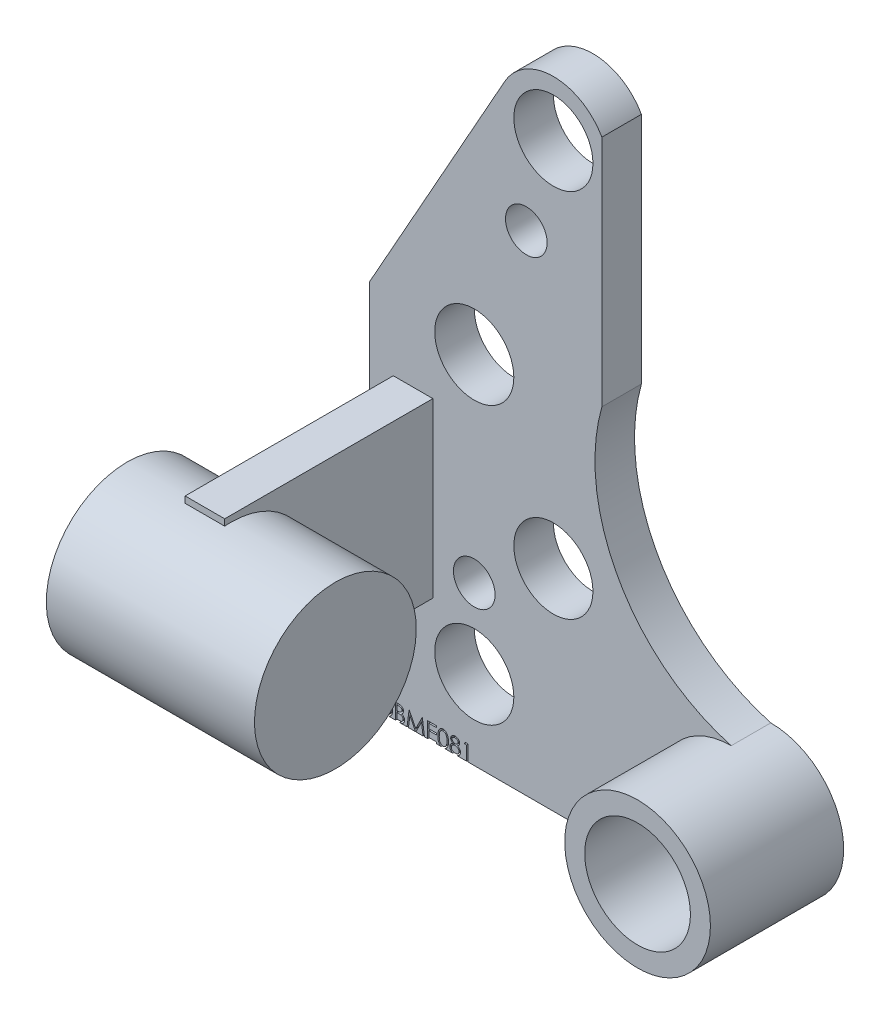
from build123d import *

# Parameters (mm, degrees)
SKETCH1_R           = 19
SKETCH1_R_2         = 10
SKETCH1_R_3         = 25.4
BOSS_EXTRUDE1_DEPTH = 19
SKETCH1_6_R         = 25.4
BOSS_EXTRUDE2_DEPTH = 64
CUT_EXTRUDE1_DEPTH  = 5
SKETCH2_W           = 19
SKETCH2_H           = 83
BOSS_EXTRUDE5_DEPTH = 100
SKETCH6_R           = 38.858564493
BOSS_EXTRUDE6_DEPTH = 50


with BuildPart() as part:
    # Sketch1 → Boss-Extrude1 (new body)
    with BuildSketch(Plane.XY):
        with BuildLine():
            Line((-50.379383599, 137.990211841), (-50.379383599, -38.009788159))
            Line((-50.379383599, -38.009788159), (123.435859453, -38.009788159))
            ThreePointArc((123.435859453, -38.009788159), (158.435859453, -3.009788159), (123.435859453, 31.990211841))
            ThreePointArc((123.435859453, 31.990211841), (69.500354361, 74.012890391), (61.288003042, 141.891469545))
            Line((61.288003042, 141.891469545), (61.288003042, 254.059820607))
            ThreePointArc((61.288003042, 254.059820607), (38, 267.7), (14.711996958, 254.059820607))
            Line((14.711996958, 254.059820607), (-50.379383599, 137.990211841))
        make_face()
        Circle(SKETCH1_R, mode=Mode.SUBTRACT)
        with Locations((0, 38)):
            Circle(SKETCH1_R_2, mode=Mode.SUBTRACT)
        with Locations((38, 63)):
            Circle(SKETCH1_R, mode=Mode.SUBTRACT)
        with Locations((0, 133)):
            Circle(SKETCH1_R, mode=Mode.SUBTRACT)
        with Locations((25, 197)):
            Circle(SKETCH1_R_2, mode=Mode.SUBTRACT)
        with Locations((38, 241)):
            Circle(SKETCH1_R, mode=Mode.SUBTRACT)
        with Locations((123.435859453, -3.009788159)):
            Circle(SKETCH1_R_3, mode=Mode.SUBTRACT)
    extrude(amount=BOSS_EXTRUDE1_DEPTH)

    # Sketch1<6> → Boss-Extrude2 (add)
    with BuildSketch(Plane.XY):
        with BuildLine():
            ThreePointArc((123.435859453, 31.990211841), (88.435859453, -3.009788159), (123.435859453, -38.009788159))
            ThreePointArc((123.435859453, -38.009788159), (148.184596795, -27.7585255), (158.435859453, -3.009788159))
            ThreePointArc((158.435859453, -3.009788159), (148.184596795, 21.738949183), (123.435859453, 31.990211841))
        make_face()
        with Locations((123.435859453, -3.009788159)):
            Circle(SKETCH1_6_R, mode=Mode.SUBTRACT)
    extrude(amount=BOSS_EXTRUDE2_DEPTH)

    # Sketch5 → Cut-Extrude1 (cut)
    # profile 1 of 8: a face of its own
    with BuildSketch(Plane.XY.offset(19)):
        with BuildLine():
            Line((-49.129383599, -32.817480467), (-49.802460522, -32.817480467))
            add(Edge.make_bspline(
                [(-49.802460522, -32.817480467), (-49.798073766, -32.728185707), (-49.789458293, -32.552813176), (-49.749111959, -32.297119091), (-49.691381508, -32.052715951), (-49.609756963, -31.821566135), (-49.508386368, -31.601625834), (-49.386822024, -31.393768657), (-49.242835201, -31.198787538), (-49.079535057, -31.018490017), (-48.902173687, -30.85308808), (-48.710803817, -30.710255417), (-48.50970733, -30.589574692), (-48.299494332, -30.488686317), (-48.077793125, -30.412958076), (-47.846615572, -30.356768848), (-47.604945994, -30.322962393), (-47.440288804, -30.319328566), (-47.356547061, -30.317480467)],
                knots=[0, 0, 0, 0, 1.10065271, 2.161652631, 3.183658789, 4.190468796, 5.17591951, 6.163126047, 7.15150782, 8.156236427, 9.156009102, 10.134482811, 11.092018607, 12.041330605, 13.001268258, 13.972401359, 14.968799086, 16, 16, 16, 16], degree=3))
            add(Edge.make_bspline(
                [(-47.356547061, -30.317480467), (-47.274308331, -30.31940573), (-47.112712163, -30.323188805), (-46.87686499, -30.355676725), (-46.652342216, -30.406560135), (-46.439582716, -30.477950313), (-46.240284006, -30.573916943), (-46.052948911, -30.689197383), (-45.875347173, -30.822525593), (-45.715475494, -30.979498051), (-45.568672467, -31.147074589), (-45.442024778, -31.32597724), (-45.333567999, -31.51075428), (-45.243165828, -31.702814712), (-45.176616958, -31.903966916), (-45.126092227, -32.111282351), (-45.097533483, -32.326906946), (-45.093150433, -32.472849565), (-45.090922061, -32.547047774)],
                knots=[0, 0, 0, 0, 1.111607364, 2.184268762, 3.212621178, 4.221274766, 5.211760367, 6.196651075, 7.1921475, 8.207485113, 9.220403448, 10.201281604, 11.166441695, 12.114753415, 13.065576456, 14.026450734, 14.996634279, 16, 16, 16, 16], degree=3))
            add(Edge.make_bspline(
                [(-45.090922061, -32.547047774), (-45.094550481, -32.65150742), (-45.101743648, -32.858593592), (-45.163274455, -33.162911155), (-45.259374122, -33.457754196), (-45.375082744, -33.695048415), (-45.49180941, -33.886263044), (-45.596996926, -34.043695983), (-45.720135807, -34.213207701), (-45.863018302, -34.394230567), (-46.022688743, -34.588182506), (-46.200593378, -34.794946354), (-46.39800084, -35.01238586), (-46.53655477, -35.160897863), (-46.608349945, -35.237853063)],
                knots=[0, 0, 0, 0, 1.184426356, 2.348067706, 3.509069118, 4.696110526, 5.333549288, 6.050745305, 6.844228056, 7.710549037, 8.667450064, 9.695053472, 10.805634456, 12, 12, 12, 12], degree=3))
            Line((-46.608349945, -35.237853063), (-48.484852349, -37.24055739))
            Line((-48.484852349, -37.24055739), (-44.994768215, -37.24055739))
            Line((-44.994768215, -37.24055739), (-44.994768215, -38.009788159))
            Line((-44.994768215, -38.009788159), (-50.090922061, -38.009788159))
            Line((-50.090922061, -38.009788159), (-47.182268215, -34.905821813))
            add(Edge.make_bspline(
                [(-47.182268215, -34.905821813), (-47.111451314, -34.83189687), (-46.975426542, -34.689902184), (-46.783035306, -34.482595841), (-46.610237474, -34.290275397), (-46.455914489, -34.113304222), (-46.323414121, -33.949093719), (-46.205830766, -33.802962212), (-46.111618786, -33.668488389), (-46.009371509, -33.512615645), (-45.910341549, -33.322303537), (-45.825243643, -33.089731346), (-45.773354682, -32.850315804), (-45.767130035, -32.688525725), (-45.763998984, -32.607143928)],
                knots=[0, 0, 0, 0, 1.329631726, 2.553950428, 3.673215718, 4.687767853, 5.603093632, 6.413772471, 7.123043292, 7.734684054, 8.834405432, 9.900288307, 10.943827018, 12, 12, 12, 12], degree=3))
            add(Edge.make_bspline(
                [(-45.763998984, -32.607143928), (-45.765361289, -32.555969503), (-45.76804613, -32.455114538), (-45.791741196, -32.307245054), (-45.827549424, -32.164606167), (-45.878860691, -32.026759126), (-45.94658942, -31.895089872), (-46.029032377, -31.769438129), (-46.124153941, -31.647961775), (-46.234192375, -31.53406185), (-46.355074203, -31.429744981), (-46.482776167, -31.337336227), (-46.617883533, -31.260109561), (-46.759826652, -31.196802067), (-46.908209801, -31.147140536), (-47.063319969, -31.112729294), (-47.224728575, -31.091123972), (-47.334943209, -31.088200746), (-47.391102349, -31.086711236)],
                knots=[0, 0, 0, 0, 0.991446411, 1.95395049, 2.89581595, 3.838931463, 4.798493298, 5.75982156, 6.748411868, 7.785213223, 8.824556874, 9.840280684, 10.836137867, 11.835679398, 12.848801643, 13.863922112, 14.911575587, 16, 16, 16, 16], degree=3))
            add(Edge.make_bspline(
                [(-47.391102349, -31.086711236), (-47.449754134, -31.088243448), (-47.564936554, -31.091252459), (-47.734048768, -31.112301025), (-47.895375434, -31.14861354), (-48.049322369, -31.198277842), (-48.196150053, -31.261403304), (-48.335144433, -31.340028471), (-48.465993481, -31.433850242), (-48.588943174, -31.540222863), (-48.702223129, -31.658653437), (-48.801752149, -31.790674786), (-48.888717893, -31.933876391), (-48.964594822, -32.087871856), (-49.026214158, -32.254058528), (-49.07329948, -32.431846467), (-49.110557009, -32.620463712), (-49.123003839, -32.750717466), (-49.129383599, -32.817480467)],
                knots=[0, 0, 0, 0, 1.031018746, 2.02475058, 2.990194455, 3.934040569, 4.864654155, 5.795059489, 6.735614925, 7.690564532, 8.649604399, 9.611025574, 10.590972636, 11.591080095, 12.624614302, 13.701020113, 14.821632451, 16, 16, 16, 16], degree=3))
        make_face()
    # profile 2 of 8: a face of its own
    with BuildSketch(Plane.XY.offset(19)):
        with BuildLine():
            add(Edge.make_bspline(
                [(-44.321691292, -34.262792967), (-44.320988395, -34.142584279), (-44.31962301, -33.909077169), (-44.304433536, -33.568824365), (-44.27920066, -33.249623746), (-44.244620575, -32.951460033), (-44.202539189, -32.674256252), (-44.146363146, -32.418753201), (-44.082478569, -32.183768329), (-44.008437614, -31.968535368), (-43.924892352, -31.770154576), (-43.833961793, -31.584957716), (-43.732037234, -31.413225004), (-43.624943849, -31.252215453), (-43.508346552, -31.104564679), (-43.38556343, -30.968187545), (-43.251802267, -30.846235936), (-43.111610106, -30.735136717), (-42.963717682, -30.637744992), (-42.812340541, -30.551960552), (-42.656436742, -30.478675122), (-42.495580636, -30.42105276), (-42.331218012, -30.373458088), (-42.162774298, -30.340910343), (-41.989971375, -30.320431254), (-41.873332586, -30.318473394), (-41.814179272, -30.317480467)],
                knots=[0, 0, 0, 0, 1.646270934, 3.197905019, 4.663502075, 6.030701355, 7.308322542, 8.50163776, 9.611534131, 10.641858119, 11.616356847, 12.558055219, 13.465016945, 14.349605745, 15.204443733, 16.039544428, 16.859896111, 17.680448484, 18.487036065, 19.28249412, 20.06191084, 20.843045899, 21.620316918, 22.403196591, 23.190181807, 24, 24, 24, 24], degree=3))
            add(Edge.make_bspline(
                [(-41.814179272, -30.317480467), (-41.754531818, -30.318525785), (-41.635911799, -30.320604594), (-41.460539567, -30.340584471), (-41.28921882, -30.373736877), (-41.122679951, -30.420710394), (-40.95955498, -30.478986844), (-40.801119821, -30.552030667), (-40.646390361, -30.637056811), (-40.497825459, -30.736965119), (-40.35379414, -30.848355711), (-40.217834219, -30.974275716), (-40.089933321, -31.113453686), (-39.968486238, -31.264400537), (-39.85693853, -31.430011433), (-39.750709747, -31.607405954), (-39.655626812, -31.799686379), (-39.564052508, -32.003644524), (-39.485008965, -32.224923793), (-39.413724154, -32.462276851), (-39.356126364, -32.718507252), (-39.308149352, -32.992270634), (-39.270981718, -33.284572384), (-39.243911771, -33.594785917), (-39.229612303, -33.923115326), (-39.226919372, -34.147596431), (-39.225537445, -34.262792967)],
                knots=[0, 0, 0, 0, 0.810914788, 1.612654377, 2.396697861, 3.181598691, 3.963628158, 4.749916497, 5.551656086, 6.361998678, 7.18212741, 8.025565596, 8.878627764, 9.750805457, 10.657531673, 11.591944965, 12.560506719, 13.57287815, 14.630710178, 15.753379473, 16.941251878, 18.199788006, 19.531962791, 20.947069417, 22.433333509, 24, 24, 24, 24], degree=3))
            add(Edge.make_bspline(
                [(-39.225537445, -34.262792967), (-39.226933698, -34.377487055), (-39.229654239, -34.600963809), (-39.243751468, -34.927815899), (-39.271519963, -35.236383135), (-39.306255653, -35.527405554), (-39.354364859, -35.79967188), (-39.413518787, -36.05412427), (-39.47919805, -36.291861566), (-39.560272609, -36.510936162), (-39.649009845, -36.71440414), (-39.745556694, -36.904405172), (-39.848992036, -37.082618656), (-39.961682204, -37.247618114), (-40.08179666, -37.400572379), (-40.211906208, -37.538781571), (-40.348343176, -37.665575868), (-40.492798353, -37.778400784), (-40.643680248, -37.877153937), (-40.79787827, -37.96546933), (-40.958128377, -38.036682248), (-41.12079899, -38.097828765), (-41.288216918, -38.144544019), (-41.460173469, -38.176845138), (-41.635793975, -38.199499099), (-41.754511614, -38.20122727), (-41.814179272, -38.202095851)],
                knots=[0, 0, 0, 0, 1.561518951, 3.042555995, 4.452378317, 5.7783523, 7.031515105, 8.214008947, 9.334062868, 10.386615937, 11.391082383, 12.354592575, 13.286541444, 14.194233754, 15.072674879, 15.931287219, 16.775624067, 17.606195743, 18.42308326, 19.229000347, 20.022332153, 20.807536673, 21.593273796, 22.3848459, 23.188221202, 24, 24, 24, 24], degree=3))
            add(Edge.make_bspline(
                [(-41.814179272, -38.202095851), (-41.873330945, -38.201096518), (-41.989966498, -38.199126028), (-42.162793124, -38.178739461), (-42.330541217, -38.145963382), (-42.494038547, -38.100070659), (-42.654123937, -38.04389601), (-42.80861598, -37.970709545), (-42.959232445, -37.886422255), (-43.105571493, -37.790432066), (-43.244883267, -37.68045703), (-43.377951707, -37.558819269), (-43.501433891, -37.422483388), (-43.616364096, -37.273602124), (-43.725594285, -37.113545176), (-43.826071513, -36.940127234), (-43.919009058, -36.754035926), (-44.003959395, -36.554068974), (-44.079277959, -36.337308414), (-44.145808762, -36.10127446), (-44.1983391, -35.843883812), (-44.243302576, -35.567203739), (-44.279569111, -35.270045317), (-44.304328379, -34.952247221), (-44.319631197, -34.614007488), (-44.320992062, -34.382000828), (-44.321691292, -34.262792967)],
                knots=[0, 0, 0, 0, 0.810891512, 1.598919785, 2.382837074, 3.152667961, 3.926044502, 4.706494248, 5.493654104, 6.291793342, 7.103789334, 7.925228297, 8.761435821, 9.622817696, 10.50288917, 11.416980706, 12.369136599, 13.353924996, 14.394355917, 15.514179734, 16.714354668, 17.994756427, 19.357759367, 20.818452758, 22.365282078, 24, 24, 24, 24], degree=3))
        make_face()
        with BuildLine():
            add(Edge.make_bspline(
                [(-43.648614368, -34.259788159), (-43.64835841, -34.359963942), (-43.647861646, -34.554385467), (-43.634884074, -34.83690674), (-43.617205005, -35.100414588), (-43.594402225, -35.345243594), (-43.560538764, -35.57056505), (-43.522595647, -35.777928656), (-43.47642117, -35.966237021), (-43.421788989, -36.13678233), (-43.359562352, -36.292458905), (-43.291621216, -36.437318652), (-43.218633953, -36.573072802), (-43.136950058, -36.698501962), (-43.047989209, -36.814015171), (-42.953760796, -36.921656955), (-42.850748116, -37.017650486), (-42.708240096, -37.132779461), (-42.520104794, -37.251749033), (-42.283060961, -37.355347797), (-42.039485709, -37.420453061), (-41.874161602, -37.428732538), (-41.791643215, -37.432865082)],
                knots=[0, 0, 0, 0, 1.459021318, 2.831673884, 4.118529203, 5.306027144, 6.411944654, 7.436330062, 8.375795394, 9.233974572, 10.042671642, 10.816086306, 11.563610507, 12.285937304, 12.993564865, 13.685989202, 14.367179055, 15.041617293, 16.353048772, 17.594441528, 18.799311195, 20, 20, 20, 20], degree=3))
            add(Edge.make_bspline(
                [(-41.791643215, -37.432865082), (-41.708591061, -37.429441266), (-41.542658226, -37.422600703), (-41.300228665, -37.356603408), (-41.064878086, -37.257025824), (-40.880438214, -37.139281169), (-40.740118478, -37.027149035), (-40.63958207, -36.931546217), (-40.547306252, -36.82449793), (-40.459787521, -36.708999439), (-40.379518073, -36.582844115), (-40.306525635, -36.446638597), (-40.239918461, -36.300004644), (-40.201970506, -36.197640918), (-40.182568695, -36.145304986)],
                knots=[0, 0, 0, 0, 1.353760809, 2.704726607, 4.075137775, 5.516104923, 6.260822281, 7.007110065, 7.778089737, 8.566572457, 9.372053459, 10.217411131, 11.088608312, 12, 12, 12, 12], degree=3))
            add(Edge.make_bspline(
                [(-40.182568695, -36.145304986), (-40.159957764, -36.078384115), (-40.114047878, -35.942506049), (-40.05487979, -35.731726795), (-40.008282506, -35.510578015), (-39.966361008, -35.280381336), (-39.937747317, -35.03943912), (-39.914716288, -34.788496869), (-39.90115053, -34.527365378), (-39.899468921, -34.34994754), (-39.898614368, -34.259788159)],
                knots=[0, 0, 0, 0, 0.884706709, 1.796334032, 2.740027952, 3.714592787, 4.726048262, 5.777819803, 6.87074269, 8, 8, 8, 8], degree=3))
            add(Edge.make_bspline(
                [(-39.898614368, -34.259788159), (-39.899793345, -34.169643361), (-39.902099676, -33.993300865), (-39.910915364, -33.73504762), (-39.933680167, -33.489759561), (-39.958963993, -33.256379977), (-39.996243752, -33.036200757), (-40.036439053, -32.827378674), (-40.090441651, -32.632500764), (-40.148126883, -32.448515946), (-40.214149159, -32.277514543), (-40.286825732, -32.118699287), (-40.364443787, -31.971303448), (-40.448748588, -31.83573143), (-40.538739337, -31.711375981), (-40.636791228, -31.600730422), (-40.739014884, -31.50036549), (-40.882194568, -31.385802842), (-41.069639475, -31.268992066), (-41.302880148, -31.161494009), (-41.545602957, -31.099761953), (-41.70968893, -31.091058338), (-41.791643215, -31.086711236)],
                knots=[0, 0, 0, 0, 1.31362396, 2.569729283, 3.763502607, 4.902122613, 5.988968491, 7.01645872, 7.998833611, 8.933434873, 9.825090667, 10.667526885, 11.477055099, 12.250526234, 12.991942729, 13.710640831, 14.402115721, 15.076753259, 16.378508321, 17.609869233, 18.806226677, 20, 20, 20, 20], degree=3))
            add(Edge.make_bspline(
                [(-41.791643215, -31.086711236), (-41.874594483, -31.091064336), (-42.040648138, -31.099778466), (-42.285893755, -31.161264009), (-42.520974509, -31.268434651), (-42.70792374, -31.386189734), (-42.851203283, -31.498343259), (-42.952094769, -31.595599946), (-43.046693709, -31.701984777), (-43.133838781, -31.818560309), (-43.215458674, -31.943843239), (-43.290417986, -32.078819163), (-43.357955121, -32.224172087), (-43.420279127, -32.379778734), (-43.475077959, -32.550309329), (-43.520279309, -32.738385744), (-43.56203728, -32.945089798), (-43.59159857, -33.171631601), (-43.617878047, -33.416521929), (-43.634766649, -33.680687611), (-43.647905058, -33.963682712), (-43.648373196, -34.15910948), (-43.648614368, -34.259788159)],
                knots=[0, 0, 0, 0, 1.207732386, 2.417664972, 3.655092373, 4.956220595, 5.625982001, 6.301752483, 6.994047911, 7.697131622, 8.419323945, 9.170223765, 9.943494443, 10.752040957, 11.610060368, 12.549350801, 13.567764191, 14.679664412, 15.874934091, 17.154273443, 18.533957287, 20, 20, 20, 20], degree=3))
        make_face(mode=Mode.SUBTRACT)
    # profile 3 of 8: a face of its own
    with BuildSketch(Plane.XY.offset(19)):
        with BuildLine():
            Line((-37.879383599, -30.509788159), (-36.416042253, -30.509788159))
            add(Edge.make_bspline(
                [(-36.416042253, -30.509788159), (-36.3444098, -30.510164767), (-36.205568278, -30.510894727), (-36.003669474, -30.522215722), (-35.814564879, -30.537652158), (-35.638199653, -30.562145213), (-35.474655291, -30.591699021), (-35.323438925, -30.627488627), (-35.185031413, -30.6704028), (-35.019789835, -30.738644831), (-34.831388419, -30.84005162), (-34.627391863, -30.989898545), (-34.452954208, -31.173182395), (-34.302554956, -31.379930942), (-34.182981129, -31.607364739), (-34.096475491, -31.850063001), (-34.041708616, -32.104895305), (-34.036076257, -32.279844972), (-34.033229753, -32.368261717)],
                knots=[0, 0, 0, 0, 1.001505555, 1.941167018, 2.826882275, 3.653841531, 4.429895133, 5.150066043, 5.825578002, 6.45369114, 7.647487171, 8.808567382, 9.977351308, 11.170798116, 12.373658725, 13.556498008, 14.765093433, 16, 16, 16, 16], degree=3))
            add(Edge.make_bspline(
                [(-34.033229753, -32.368261717), (-34.035572364, -32.451088622), (-34.040175815, -32.613851301), (-34.084196014, -32.851910106), (-34.153111732, -33.078519861), (-34.248908695, -33.292853544), (-34.373412972, -33.490068429), (-34.520966512, -33.671755428), (-34.698988232, -33.830221979), (-34.832366603, -33.918813913), (-34.900116772, -33.963814601)],
                knots=[0, 0, 0, 0, 1.044552857, 2.05264487, 3.044412934, 4.028983338, 5.005914585, 5.980388656, 6.974128949, 8, 8, 8, 8], degree=3))
            add(Edge.make_bspline(
                [(-34.900116772, -33.963814601), (-34.814915856, -33.996525313), (-34.651905397, -34.059109008), (-34.427578228, -34.169756431), (-34.23430356, -34.290103811), (-34.07059539, -34.421529204), (-33.930586129, -34.563190941), (-33.808329826, -34.717166186), (-33.704012596, -34.885463524), (-33.61462776, -35.066328243), (-33.544880425, -35.257913532), (-33.492646344, -35.458422338), (-33.462716096, -35.667135671), (-33.458456865, -35.809175769), (-33.456306676, -35.880881909)],
                knots=[0, 0, 0, 0, 1.27268992, 2.434971085, 3.483601985, 4.442670788, 5.356604649, 6.2567628, 7.179492994, 8.113709626, 9.066344395, 10.018646069, 10.999752585, 12, 12, 12, 12], degree=3))
            add(Edge.make_bspline(
                [(-33.456306676, -35.880881909), (-33.458399918, -35.954096635), (-33.462518429, -36.098148659), (-33.492904083, -36.309766805), (-33.544352169, -36.511998833), (-33.615218911, -36.706152796), (-33.707709585, -36.891853084), (-33.820269509, -37.069310079), (-33.954480003, -37.236740787), (-34.104614722, -37.396005694), (-34.274462176, -37.539208095), (-34.457710223, -37.666741752), (-34.656666622, -37.771626171), (-34.868063752, -37.859731931), (-35.094273001, -37.927033071), (-35.334278588, -37.974117158), (-35.587873521, -38.005842237), (-35.761894416, -38.008450533), (-35.851138407, -38.009788159)],
                knots=[0, 0, 0, 0, 0.978564426, 1.925352924, 2.850884081, 3.763762016, 4.682927383, 5.618979971, 6.567305752, 7.547517671, 8.540179244, 9.531824382, 10.526200242, 11.540722885, 12.589160233, 13.674978461, 14.80764778, 16, 16, 16, 16], degree=3))
            Line((-35.851138407, -38.009788159), (-37.879383599, -38.009788159))
            Line((-37.879383599, -38.009788159), (-37.879383599, -30.509788159))
        make_face()
        with BuildLine():
            Line((-37.206306676, -31.279018928), (-37.206306676, -33.682865082))
            Line((-37.206306676, -33.682865082), (-36.754083118, -33.682865082))
            add(Edge.make_bspline(
                [(-36.754083118, -33.682865082), (-36.687978557, -33.682008104), (-36.560251073, -33.680352248), (-36.375279866, -33.675608997), (-36.203583398, -33.662327476), (-36.045458042, -33.649049771), (-35.901152805, -33.627461369), (-35.770987387, -33.601763963), (-35.652918965, -33.574586309), (-35.516762796, -33.52836598), (-35.362320764, -33.460056676), (-35.197678398, -33.354045599), (-35.052533106, -33.227779128), (-34.929967703, -33.082084209), (-34.829657409, -32.921656668), (-34.759985163, -32.74905621), (-34.712740982, -32.568584499), (-34.708473415, -32.444688243), (-34.706306676, -32.381783351)],
                knots=[0, 0, 0, 0, 1.156816544, 2.235205308, 3.236616184, 4.169592532, 5.011045266, 5.787822928, 6.49130361, 7.128639758, 8.301311294, 9.436451833, 10.541879658, 11.654887649, 12.756523258, 13.837046038, 14.901820046, 16, 16, 16, 16], degree=3))
            add(Edge.make_bspline(
                [(-34.706306676, -32.381783351), (-34.707434205, -32.340156698), (-34.709645976, -32.258501472), (-34.727760196, -32.139467142), (-34.758547856, -32.027516243), (-34.79809277, -31.921114578), (-34.853354246, -31.823589185), (-34.91841881, -31.731568051), (-34.997031003, -31.64818494), (-35.086510959, -31.570250301), (-35.189386579, -31.501154884), (-35.30559649, -31.440638963), (-35.436712941, -31.391908728), (-35.580526202, -31.349231258), (-35.739249961, -31.319256343), (-35.911052575, -31.294284798), (-36.097341259, -31.281571779), (-36.226223621, -31.279888859), (-36.292845138, -31.279018928)],
                knots=[0, 0, 0, 0, 0.91205012, 1.789085906, 2.630437955, 3.453916878, 4.269457761, 5.079663411, 5.91843418, 6.774407191, 7.675494373, 8.627863946, 9.638891023, 10.736472738, 11.911756761, 13.175263542, 14.539845004, 16, 16, 16, 16], degree=3))
            Line((-36.292845138, -31.279018928), (-37.206306676, -31.279018928))
        make_face(mode=Mode.SUBTRACT)
        with BuildLine():
            Line((-37.206306676, -34.452095851), (-37.206306676, -37.24055739))
            Line((-37.206306676, -37.24055739), (-36.247773022, -37.24055739))
            add(Edge.make_bspline(
                [(-36.247773022, -37.24055739), (-36.179161038, -37.239735074), (-36.046920484, -37.238150168), (-35.855989277, -37.232976123), (-35.679025483, -37.221206961), (-35.516836621, -37.20268014), (-35.367671365, -37.182583463), (-35.233319144, -37.15555929), (-35.112690872, -37.124597231), (-34.972817356, -37.076738291), (-34.815309838, -37.00238871), (-34.645572289, -36.890286797), (-34.494658964, -36.756736851), (-34.366504837, -36.602170607), (-34.261477005, -36.434103478), (-34.185072458, -36.255934871), (-34.137949194, -36.07060874), (-34.132244545, -35.944251499), (-34.129383599, -35.880881909)],
                knots=[0, 0, 0, 0, 1.160039823, 2.235823828, 3.228722157, 4.157150951, 4.99529583, 5.772374946, 6.472645482, 7.099169577, 8.269452708, 9.405989375, 10.527446681, 11.663510218, 12.788923519, 13.866172445, 14.929861265, 16, 16, 16, 16], degree=3))
            add(Edge.make_bspline(
                [(-34.129383599, -35.880881909), (-34.129975251, -35.841253322), (-34.131149012, -35.762635361), (-34.14885033, -35.647101463), (-34.174594337, -35.535188877), (-34.207875981, -35.426593719), (-34.256346267, -35.323279341), (-34.312931721, -35.223202428), (-34.379277582, -35.126230686), (-34.482657937, -35.003633), (-34.633026475, -34.862382258), (-34.846683851, -34.724087611), (-35.08962449, -34.612556595), (-35.26582626, -34.565200575), (-35.356847542, -34.540737678)],
                knots=[0, 0, 0, 0, 0.723448775, 1.435228256, 2.130040452, 2.821711965, 3.505591119, 4.210454504, 4.921174351, 5.648778258, 7.137944449, 8.670945889, 10.280296675, 12, 12, 12, 12], degree=3))
            add(Edge.make_bspline(
                [(-35.356847542, -34.540737678), (-35.393338461, -34.533333927), (-35.472458302, -34.517281067), (-35.601474546, -34.500335988), (-35.748765693, -34.485239431), (-35.914671859, -34.474072665), (-36.099402947, -34.462530071), (-36.303353487, -34.458041169), (-36.52569059, -34.452685612), (-36.679959959, -34.452297467), (-36.760092734, -34.452095851)],
                knots=[0, 0, 0, 0, 0.634451884, 1.375622551, 2.216452059, 3.157844607, 4.20941857, 5.370758133, 6.634282058, 8, 8, 8, 8], degree=3))
            Line((-36.760092734, -34.452095851), (-37.206306676, -34.452095851))
        make_face(mode=Mode.SUBTRACT)
    # profile 4 of 8: a face of its own
    with BuildSketch(Plane.XY.offset(19)):
        Polygon((-32.302460522, -38.009788159), (-31.312376388, -30.509788159), (-31.216222542, -30.509788159), (-28.119768215, -36.663634313), (-25.030825907, -30.509788159), (-24.933169657, -30.509788159), (-23.937075907, -38.009788159), (-24.613157638, -38.009788159), (-25.331306676, -32.613153543), (-28.038638407, -38.009788159), (-28.190381195, -38.009788159), (-30.908229753, -32.601134313), (-31.624876388, -38.009788159), align=None)
    # profile 5 of 8: a face of its own
    with BuildSketch(Plane.XY.offset(19)):
        Polygon((-22.398614368, -30.509788159), (-18.167845138, -30.509788159), (-18.167845138, -31.279018928), (-21.725537445, -31.279018928), (-21.725537445, -33.586711236), (-18.167845138, -33.586711236), (-18.167845138, -34.355942005), (-21.725537445, -34.355942005), (-21.725537445, -37.24055739), (-18.167845138, -37.24055739), (-18.167845138, -38.009788159), (-22.398614368, -38.009788159), align=None)
    # profile 6 of 8: a face of its own
    with BuildSketch(Plane.XY.offset(19)):
        with BuildLine():
            add(Edge.make_bspline(
                [(-17.494768215, -34.262792967), (-17.494065319, -34.142584279), (-17.492699933, -33.909077169), (-17.477510459, -33.568824365), (-17.452277583, -33.249623746), (-17.417697498, -32.951460033), (-17.375616112, -32.674256252), (-17.319440069, -32.418753201), (-17.255555492, -32.183768329), (-17.181514537, -31.968535368), (-17.097969275, -31.770154576), (-17.007038716, -31.584957716), (-16.905114157, -31.413225004), (-16.798020772, -31.252215453), (-16.681423476, -31.104564679), (-16.558640353, -30.968187545), (-16.42487919, -30.846235936), (-16.284687029, -30.735136717), (-16.136794605, -30.637744992), (-15.985417464, -30.551960552), (-15.829513665, -30.478675122), (-15.668657559, -30.42105276), (-15.504294935, -30.373458088), (-15.335851221, -30.340910343), (-15.163048298, -30.320431254), (-15.046409509, -30.318473394), (-14.987256195, -30.317480467)],
                knots=[0, 0, 0, 0, 1.646270934, 3.197905019, 4.663502075, 6.030701355, 7.308322542, 8.50163776, 9.611534131, 10.641858119, 11.616356847, 12.558055219, 13.465016945, 14.349605745, 15.204443733, 16.039544428, 16.859896111, 17.680448484, 18.487036065, 19.28249412, 20.06191084, 20.843045899, 21.620316918, 22.403196591, 23.190181807, 24, 24, 24, 24], degree=3))
            add(Edge.make_bspline(
                [(-14.987256195, -30.317480467), (-14.927608741, -30.318525785), (-14.808988722, -30.320604594), (-14.63361649, -30.340584471), (-14.462295743, -30.373736877), (-14.295756875, -30.420710394), (-14.132631904, -30.478986844), (-13.974196744, -30.552030667), (-13.819467284, -30.637056811), (-13.670902382, -30.736965119), (-13.526871063, -30.848355711), (-13.390911143, -30.974275716), (-13.263010244, -31.113453686), (-13.141563161, -31.264400537), (-13.030015453, -31.430011433), (-12.92378667, -31.607405954), (-12.828703736, -31.799686379), (-12.737129432, -32.003644524), (-12.658085889, -32.224923793), (-12.586801077, -32.462276851), (-12.529203287, -32.718507252), (-12.481226275, -32.992270634), (-12.444058641, -33.284572384), (-12.416988694, -33.594785917), (-12.402689226, -33.923115326), (-12.399996295, -34.147596431), (-12.398614368, -34.262792967)],
                knots=[0, 0, 0, 0, 0.810914788, 1.612654377, 2.396697861, 3.181598691, 3.963628158, 4.749916497, 5.551656086, 6.361998678, 7.18212741, 8.025565596, 8.878627764, 9.750805457, 10.657531673, 11.591944965, 12.560506719, 13.57287815, 14.630710178, 15.753379473, 16.941251878, 18.199788006, 19.531962791, 20.947069417, 22.433333509, 24, 24, 24, 24], degree=3))
            add(Edge.make_bspline(
                [(-12.398614368, -34.262792967), (-12.400010621, -34.377487055), (-12.402731162, -34.600963809), (-12.416828391, -34.927815899), (-12.444596886, -35.236383135), (-12.479332576, -35.527405554), (-12.527441782, -35.79967188), (-12.58659571, -36.05412427), (-12.652274973, -36.291861566), (-12.733349532, -36.510936162), (-12.822086768, -36.71440414), (-12.918633617, -36.904405172), (-13.022068959, -37.082618656), (-13.134759127, -37.247618114), (-13.254873583, -37.400572379), (-13.384983131, -37.538781571), (-13.521420099, -37.665575868), (-13.665875276, -37.778400784), (-13.816757171, -37.877153937), (-13.970955193, -37.96546933), (-14.1312053, -38.036682248), (-14.293875913, -38.097828765), (-14.461293841, -38.144544019), (-14.633250392, -38.176845138), (-14.808870898, -38.199499099), (-14.927588537, -38.20122727), (-14.987256195, -38.202095851)],
                knots=[0, 0, 0, 0, 1.561518951, 3.042555995, 4.452378317, 5.7783523, 7.031515105, 8.214008947, 9.334062868, 10.386615937, 11.391082383, 12.354592575, 13.286541444, 14.194233754, 15.072674879, 15.931287219, 16.775624067, 17.606195743, 18.42308326, 19.229000347, 20.022332153, 20.807536673, 21.593273796, 22.3848459, 23.188221202, 24, 24, 24, 24], degree=3))
            add(Edge.make_bspline(
                [(-14.987256195, -38.202095851), (-15.046407868, -38.201096518), (-15.163043421, -38.199126028), (-15.335870047, -38.178739461), (-15.50361814, -38.145963382), (-15.66711547, -38.100070659), (-15.82720086, -38.04389601), (-15.981692903, -37.970709545), (-16.132309368, -37.886422255), (-16.278648416, -37.790432066), (-16.41796019, -37.68045703), (-16.55102863, -37.558819269), (-16.674510814, -37.422483388), (-16.789441019, -37.273602124), (-16.898671208, -37.113545176), (-16.999148436, -36.940127234), (-17.092085981, -36.754035926), (-17.177036318, -36.554068974), (-17.252354882, -36.337308414), (-17.318885686, -36.10127446), (-17.371416023, -35.843883812), (-17.416379499, -35.567203739), (-17.452646034, -35.270045317), (-17.477405302, -34.952247221), (-17.49270812, -34.614007488), (-17.494068985, -34.382000828), (-17.494768215, -34.262792967)],
                knots=[0, 0, 0, 0, 0.810891512, 1.598919785, 2.382837074, 3.152667961, 3.926044502, 4.706494248, 5.493654104, 6.291793342, 7.103789334, 7.925228297, 8.761435821, 9.622817696, 10.50288917, 11.416980706, 12.369136599, 13.353924996, 14.394355917, 15.514179734, 16.714354668, 17.994756427, 19.357759367, 20.818452758, 22.365282078, 24, 24, 24, 24], degree=3))
        make_face()
        with BuildLine():
            add(Edge.make_bspline(
                [(-16.821691292, -34.259788159), (-16.821435334, -34.359963942), (-16.820938569, -34.554385467), (-16.807960997, -34.83690674), (-16.790281928, -35.100414588), (-16.767479148, -35.345243594), (-16.733615687, -35.57056505), (-16.69567257, -35.777928656), (-16.649498093, -35.966237021), (-16.594865912, -36.13678233), (-16.532639275, -36.292458905), (-16.464698139, -36.437318652), (-16.391710876, -36.573072802), (-16.310026982, -36.698501962), (-16.221066132, -36.814015171), (-16.126837719, -36.921656955), (-16.023825039, -37.017650486), (-15.881317019, -37.132779461), (-15.693181717, -37.251749033), (-15.456137884, -37.355347797), (-15.212562632, -37.420453061), (-15.047238525, -37.428732538), (-14.964720138, -37.432865082)],
                knots=[0, 0, 0, 0, 1.459021318, 2.831673884, 4.118529203, 5.306027144, 6.411944654, 7.436330062, 8.375795394, 9.233974572, 10.042671642, 10.816086306, 11.563610507, 12.285937304, 12.993564865, 13.685989202, 14.367179055, 15.041617293, 16.353048772, 17.594441528, 18.799311195, 20, 20, 20, 20], degree=3))
            add(Edge.make_bspline(
                [(-14.964720138, -37.432865082), (-14.881667984, -37.429441266), (-14.715735149, -37.422600703), (-14.473305588, -37.356603408), (-14.237955009, -37.257025824), (-14.053515137, -37.139281169), (-13.913195401, -37.027149035), (-13.812658993, -36.931546217), (-13.720383175, -36.82449793), (-13.632864444, -36.708999439), (-13.552594996, -36.582844115), (-13.479602558, -36.446638597), (-13.412995384, -36.300004644), (-13.375047429, -36.197640918), (-13.355645618, -36.145304986)],
                knots=[0, 0, 0, 0, 1.353760809, 2.704726607, 4.075137775, 5.516104923, 6.260822281, 7.007110065, 7.778089737, 8.566572457, 9.372053459, 10.217411131, 11.088608312, 12, 12, 12, 12], degree=3))
            add(Edge.make_bspline(
                [(-13.355645618, -36.145304986), (-13.333034687, -36.078384115), (-13.287124801, -35.942506049), (-13.227956713, -35.731726795), (-13.181359429, -35.510578015), (-13.139437931, -35.280381336), (-13.11082424, -35.03943912), (-13.087793211, -34.788496869), (-13.074227454, -34.527365378), (-13.072545844, -34.34994754), (-13.071691292, -34.259788159)],
                knots=[0, 0, 0, 0, 0.884706709, 1.796334032, 2.740027952, 3.714592787, 4.726048262, 5.777819803, 6.87074269, 8, 8, 8, 8], degree=3))
            add(Edge.make_bspline(
                [(-13.071691292, -34.259788159), (-13.072870268, -34.169643361), (-13.075176599, -33.993300865), (-13.083992287, -33.73504762), (-13.10675709, -33.489759561), (-13.132040916, -33.256379977), (-13.169320675, -33.036200757), (-13.209515976, -32.827378674), (-13.263518574, -32.632500764), (-13.321203806, -32.448515946), (-13.387226082, -32.277514543), (-13.459902655, -32.118699287), (-13.53752071, -31.971303448), (-13.621825511, -31.83573143), (-13.71181626, -31.711375981), (-13.809868151, -31.600730422), (-13.912091807, -31.50036549), (-14.055271491, -31.385802842), (-14.242716398, -31.268992066), (-14.475957071, -31.161494009), (-14.71867988, -31.099761953), (-14.882765853, -31.091058338), (-14.964720138, -31.086711236)],
                knots=[0, 0, 0, 0, 1.31362396, 2.569729283, 3.763502607, 4.902122613, 5.988968491, 7.01645872, 7.998833611, 8.933434873, 9.825090667, 10.667526885, 11.477055099, 12.250526234, 12.991942729, 13.710640831, 14.402115721, 15.076753259, 16.378508321, 17.609869233, 18.806226677, 20, 20, 20, 20], degree=3))
            add(Edge.make_bspline(
                [(-14.964720138, -31.086711236), (-15.047671406, -31.091064336), (-15.213725061, -31.099778466), (-15.458970679, -31.161264009), (-15.694051432, -31.268434651), (-15.881000664, -31.386189734), (-16.024280206, -31.498343259), (-16.125171692, -31.595599946), (-16.219770632, -31.701984777), (-16.306915704, -31.818560309), (-16.388535597, -31.943843239), (-16.463494909, -32.078819163), (-16.531032044, -32.224172087), (-16.59335605, -32.379778734), (-16.648154882, -32.550309329), (-16.693356232, -32.738385744), (-16.735114203, -32.945089798), (-16.764675493, -33.171631601), (-16.79095497, -33.416521929), (-16.807843573, -33.680687611), (-16.820981981, -33.963682712), (-16.821450119, -34.15910948), (-16.821691292, -34.259788159)],
                knots=[0, 0, 0, 0, 1.207732386, 2.417664972, 3.655092373, 4.956220595, 5.625982001, 6.301752483, 6.994047911, 7.697131622, 8.419323945, 9.170223765, 9.943494443, 10.752040957, 11.610060368, 12.549350801, 13.567764191, 14.679664412, 15.874934091, 17.154273443, 18.533957287, 20, 20, 20, 20], degree=3))
        make_face(mode=Mode.SUBTRACT)
    # profile 7 of 8: a face of its own
    with BuildSketch(Plane.XY.offset(19)):
        with BuildLine():
            add(Edge.make_bspline(
                [(-8.079203311, -33.831603063), (-8.017813567, -33.863612968), (-7.898083064, -33.926042975), (-7.727560475, -34.026566177), (-7.571721187, -34.132511101), (-7.426241411, -34.238873657), (-7.293677088, -34.349727196), (-7.175510489, -34.465512531), (-7.068822732, -34.583339556), (-6.975765338, -34.7052035), (-6.893914974, -34.830780605), (-6.823174684, -34.960400476), (-6.762709249, -35.093779048), (-6.714788666, -35.232372255), (-6.675313398, -35.374144244), (-6.648151388, -35.520925634), (-6.633543707, -35.671749222), (-6.630781963, -35.773681297), (-6.629383599, -35.825292967)],
                knots=[0, 0, 0, 0, 1.272397273, 2.481599622, 3.635517121, 4.734568067, 5.792894095, 6.808321871, 7.773003508, 8.711915296, 9.623354172, 10.525449501, 11.423591555, 12.311487226, 13.218079475, 14.126165749, 15.051214107, 16, 16, 16, 16], degree=3))
            add(Edge.make_bspline(
                [(-6.629383599, -35.825292967), (-6.631036643, -35.897502394), (-6.634308638, -36.040431944), (-6.662808603, -36.251387897), (-6.705479272, -36.456270287), (-6.767792512, -36.655034196), (-6.848606921, -36.846582853), (-6.948200141, -37.031080225), (-7.060938438, -37.211550173), (-7.15147895, -37.322591748), (-7.197292253, -37.378778543)],
                knots=[0, 0, 0, 0, 1.025265484, 2.029385089, 3.018602448, 3.995076438, 4.983346944, 5.966715145, 6.97116228, 8, 8, 8, 8], degree=3))
            add(Edge.make_bspline(
                [(-7.197292253, -37.378778543), (-7.256941841, -37.444336631), (-7.37550391, -37.574642687), (-7.578610183, -37.743822994), (-7.80151422, -37.886000267), (-8.043353504, -38.001868612), (-8.303481579, -38.092052596), (-8.581843017, -38.156857991), (-8.878980488, -38.193977482), (-9.083206497, -38.199343175), (-9.187977349, -38.202095851)],
                knots=[0, 0, 0, 0, 0.954267603, 1.896743057, 2.838368354, 3.796610408, 4.779680527, 5.799409237, 6.871065594, 8, 8, 8, 8], degree=3))
            add(Edge.make_bspline(
                [(-9.187977349, -38.202095851), (-9.288720325, -38.199626256), (-9.484755923, -38.194820673), (-9.770094232, -38.162261177), (-10.036072238, -38.105201463), (-10.284236456, -38.027105871), (-10.513090799, -37.925512525), (-10.721983159, -37.799065935), (-10.913927385, -37.652855702), (-11.0830984, -37.482682677), (-11.233287922, -37.300415808), (-11.365219465, -37.112376644), (-11.474878204, -36.918548021), (-11.56772198, -36.721820091), (-11.638796314, -36.519435475), (-11.688022479, -36.312435447), (-11.719285295, -36.101181569), (-11.72344487, -35.958613741), (-11.725537445, -35.886891524)],
                knots=[0, 0, 0, 0, 1.256902934, 2.445805442, 3.576955095, 4.645999104, 5.686449165, 6.692658513, 7.68621702, 8.689161843, 9.678783111, 10.630372946, 11.551080876, 12.453998257, 13.34127905, 14.221779781, 15.105423033, 16, 16, 16, 16], degree=3))
            add(Edge.make_bspline(
                [(-11.725537445, -35.886891524), (-11.724299129, -35.834264684), (-11.721851778, -35.730255473), (-11.704912818, -35.576592627), (-11.677680401, -35.427029481), (-11.640695851, -35.281013601), (-11.590572222, -35.139608017), (-11.530053366, -35.002142717), (-11.459484896, -34.868462505), (-11.3778824, -34.737836331), (-11.282949491, -34.612094519), (-11.175455956, -34.489103102), (-11.05325338, -34.37077053), (-10.917701254, -34.255651048), (-10.770348669, -34.141702532), (-10.607368247, -34.035083114), (-10.43308053, -33.928244618), (-10.309211804, -33.864369635), (-10.245669657, -33.831603063)],
                knots=[0, 0, 0, 0, 0.941657376, 1.861047343, 2.762797495, 3.66048619, 4.553285746, 5.444104102, 6.34607688, 7.256116206, 8.197091036, 9.162375105, 10.176350973, 11.237807142, 12.343728897, 13.50695164, 14.721116704, 16, 16, 16, 16], degree=3))
            add(Edge.make_bspline(
                [(-10.245669657, -33.831603063), (-10.332651174, -33.784171416), (-10.501071737, -33.692330471), (-10.724077683, -33.523587315), (-10.915629019, -33.340827712), (-11.070460556, -33.140192437), (-11.192329617, -32.927949135), (-11.275940912, -32.705425737), (-11.332504806, -32.476748351), (-11.338108007, -32.320520787), (-11.340922061, -32.242059793)],
                knots=[0, 0, 0, 0, 1.166880483, 2.259407225, 3.286803203, 4.280235371, 5.237608625, 6.161067461, 7.076446754, 8, 8, 8, 8], degree=3))
            add(Edge.make_bspline(
                [(-11.340922061, -32.242059793), (-11.337417581, -32.162136454), (-11.330372964, -32.001476604), (-11.273408706, -31.762320625), (-11.180579992, -31.527427986), (-11.054320712, -31.297937172), (-10.897062392, -31.081615284), (-10.708391223, -30.88759897), (-10.492812729, -30.717645794), (-10.251403014, -30.574982566), (-9.991611081, -30.458874726), (-9.717505958, -30.378778106), (-9.433863473, -30.326414999), (-9.240796931, -30.320486453), (-9.142905234, -30.317480467)],
                knots=[0, 0, 0, 0, 0.888701115, 1.786444228, 2.72001202, 3.692817113, 4.693886446, 5.687152267, 6.695133018, 7.739871481, 8.800368666, 9.853104506, 10.91144658, 12, 12, 12, 12], degree=3))
            add(Edge.make_bspline(
                [(-9.142905234, -30.317480467), (-9.047539916, -30.320579773), (-8.859490374, -30.326691253), (-8.583073314, -30.377663134), (-8.318591434, -30.46279782), (-8.066956794, -30.57829187), (-7.83267422, -30.7205496), (-7.625669272, -30.892837187), (-7.442813739, -31.085997653), (-7.291561466, -31.302253946), (-7.166926703, -31.530862932), (-7.080139058, -31.770054048), (-7.024527685, -32.014659174), (-7.017513333, -32.180169183), (-7.013998984, -32.263093447)],
                knots=[0, 0, 0, 0, 1.072916533, 2.115669174, 3.151510826, 4.193348718, 5.225979165, 6.227137561, 7.216255879, 8.211077061, 9.189680878, 10.138522389, 11.067357538, 12, 12, 12, 12], degree=3))
            add(Edge.make_bspline(
                [(-7.013998984, -32.263093447), (-7.017073042, -32.344472013), (-7.023110318, -32.50429489), (-7.073895903, -32.737280291), (-7.159424432, -32.955470374), (-7.276197639, -33.161340986), (-7.428395112, -33.351158481), (-7.613985254, -33.527336631), (-7.831488422, -33.691322691), (-7.994904607, -33.783864901), (-8.079203311, -33.831603063)],
                knots=[0, 0, 0, 0, 0.975232327, 1.915300861, 2.843280834, 3.77672583, 4.742871857, 5.749627742, 6.839139064, 8, 8, 8, 8], degree=3))
        make_face()
        with BuildLine():
            add(Edge.make_bspline(
                [(-9.18046533, -31.086711236), (-9.2330742, -31.08810718), (-9.336000152, -31.090838257), (-9.486918733, -31.105106765), (-9.630430949, -31.132863658), (-9.768036236, -31.169803754), (-9.897847976, -31.219706586), (-10.021629165, -31.278410177), (-10.137273143, -31.349780317), (-10.246175935, -31.429840027), (-10.344213309, -31.517896254), (-10.431223062, -31.609639937), (-10.503497593, -31.70687292), (-10.564871399, -31.807176548), (-10.609403222, -31.913527783), (-10.642755302, -32.022666018), (-10.665301141, -32.135970413), (-10.666990548, -32.213405793), (-10.667845138, -32.25257662)],
                knots=[0, 0, 0, 0, 1.203892937, 2.355340988, 3.463153438, 4.544400666, 5.610487187, 6.640501085, 7.674077295, 8.714426146, 9.728707835, 10.68524104, 11.601827946, 12.495867327, 13.368432065, 14.231010473, 15.105153427, 16, 16, 16, 16], degree=3))
            add(Edge.make_bspline(
                [(-10.667845138, -32.25257662), (-10.666372209, -32.291749141), (-10.663461489, -32.369159669), (-10.6409505, -32.483472239), (-10.607400097, -32.595804317), (-10.554577251, -32.703484841), (-10.491220769, -32.810249182), (-10.413024749, -32.913429009), (-10.319833975, -33.013383405), (-10.214775174, -33.109262208), (-10.100321879, -33.199045272), (-9.979070358, -33.276987803), (-9.852542376, -33.342203755), (-9.722037942, -33.39648105), (-9.586226984, -33.438673773), (-9.445941683, -33.468606587), (-9.301158464, -33.487210866), (-9.20305722, -33.489433054), (-9.153422061, -33.49055739)],
                knots=[0, 0, 0, 0, 0.873023192, 1.725219244, 2.590779336, 3.480155217, 4.391973325, 5.357036234, 6.360879153, 7.436073238, 8.526419356, 9.601555421, 10.645666583, 11.697338044, 12.750135903, 13.812665442, 14.89329948, 16, 16, 16, 16], degree=3))
            add(Edge.make_bspline(
                [(-9.153422061, -33.49055739), (-9.089671838, -33.48868696), (-8.962801051, -33.484964575), (-8.775773911, -33.450354917), (-8.593925388, -33.395913665), (-8.419199164, -33.321428023), (-8.25611791, -33.227939751), (-8.110746335, -33.116011856), (-7.984324422, -32.98822879), (-7.878165971, -32.846579856), (-7.795859158, -32.695826453), (-7.731783855, -32.544540111), (-7.694366965, -32.391106759), (-7.689486464, -32.288320408), (-7.687075907, -32.237552582)],
                knots=[0, 0, 0, 0, 1.076279235, 2.141928126, 3.20205304, 4.278698113, 5.344010996, 6.36967002, 7.368914609, 8.37248503, 9.349703398, 10.264243087, 11.142681841, 12, 12, 12, 12], degree=3))
            add(Edge.make_bspline(
                [(-7.687075907, -32.237552582), (-7.688215687, -32.201921076), (-7.690477988, -32.131197645), (-7.709120965, -32.026758291), (-7.739926322, -31.924694897), (-7.781632922, -31.824164317), (-7.836511054, -31.726577034), (-7.90157717, -31.630398989), (-7.980615387, -31.53779378), (-8.06932203, -31.446603319), (-8.169919334, -31.362208983), (-8.282213432, -31.287991747), (-8.405628611, -31.224965268), (-8.54016779, -31.17377508), (-8.685335484, -31.135327188), (-8.840463072, -31.106535014), (-9.00684403, -31.090306918), (-9.121336354, -31.087935792), (-9.18046533, -31.086711236)],
                knots=[0, 0, 0, 0, 0.814439003, 1.616544685, 2.417341072, 3.248991801, 4.09997495, 4.973547432, 5.9003056, 6.880240646, 7.880314356, 8.896779544, 9.951930927, 11.043077905, 12.18215768, 13.381699519, 14.647792085, 16, 16, 16, 16], degree=3))
        make_face(mode=Mode.SUBTRACT)
        with BuildLine():
            add(Edge.make_bspline(
                [(-9.136895618, -34.259788159), (-9.20359373, -34.260974533), (-9.334439151, -34.26330191), (-9.526132569, -34.289207983), (-9.710103638, -34.325270968), (-9.885732073, -34.379979907), (-10.052943709, -34.451115244), (-10.212643743, -34.536689258), (-10.363610449, -34.637843779), (-10.503759149, -34.753293669), (-10.631737712, -34.877706785), (-10.744019783, -35.00941136), (-10.839371613, -35.145959645), (-10.91615715, -35.28908585), (-10.97918229, -35.435759302), (-11.02056917, -35.589632721), (-11.047101409, -35.747747963), (-11.050664191, -35.855233888), (-11.052460522, -35.909427582)],
                knots=[0, 0, 0, 0, 1.140299081, 2.23698856, 3.303958914, 4.344563908, 5.37730929, 6.408454204, 7.439741482, 8.480804886, 9.510774543, 10.48932336, 11.43758569, 12.353841022, 13.263987381, 14.161954604, 15.073269652, 16, 16, 16, 16], degree=3))
            add(Edge.make_bspline(
                [(-11.052460522, -35.909427582), (-11.049539253, -35.976779524), (-11.043743524, -36.110404202), (-10.997765013, -36.307896498), (-10.923974579, -36.499084472), (-10.821063402, -36.682410085), (-10.69363289, -36.853731742), (-10.536933316, -37.003064832), (-10.360702949, -37.135753715), (-10.158978976, -37.243069144), (-9.938632263, -37.328772405), (-9.699721415, -37.387820896), (-9.445675161, -37.426909717), (-9.270261749, -37.430848677), (-9.18046533, -37.432865082)],
                knots=[0, 0, 0, 0, 0.898778495, 1.783155532, 2.693654817, 3.627872908, 4.583023416, 5.533784346, 6.509005473, 7.520592997, 8.575161974, 9.658835044, 10.801527049, 12, 12, 12, 12], degree=3))
            add(Edge.make_bspline(
                [(-9.18046533, -37.432865082), (-9.11028597, -37.431517635), (-8.973554072, -37.428892377), (-8.774084182, -37.405718889), (-8.585845863, -37.368969694), (-8.409204153, -37.315519238), (-8.242181639, -37.250269289), (-8.087610166, -37.166329114), (-7.941513322, -37.07085985), (-7.811090202, -36.957592372), (-7.692304754, -36.836564883), (-7.588733413, -36.708443362), (-7.498824375, -36.576709864), (-7.428258041, -36.438387397), (-7.37184464, -36.296129723), (-7.331294166, -36.148625056), (-7.306273705, -35.995420986), (-7.303743214, -35.891494405), (-7.302460522, -35.838814601)],
                knots=[0, 0, 0, 0, 1.224942928, 2.386581632, 3.501229538, 4.569074225, 5.605009692, 6.626002462, 7.634866581, 8.645888296, 9.63523824, 10.59253846, 11.518950513, 12.414518923, 13.29783783, 14.186679152, 15.080837789, 16, 16, 16, 16], degree=3))
            add(Edge.make_bspline(
                [(-7.302460522, -35.838814601), (-7.304401626, -35.787648871), (-7.308229144, -35.68675899), (-7.332522054, -35.53725929), (-7.375198934, -35.392824688), (-7.433757642, -35.251717532), (-7.511716847, -35.116796924), (-7.603527283, -34.984547985), (-7.714300394, -34.858641318), (-7.839470243, -34.73809897), (-7.975882302, -34.626636677), (-8.120883327, -34.528034308), (-8.273357174, -34.444994059), (-8.432981197, -34.377458712), (-8.59940096, -34.324342705), (-8.772494057, -34.287237001), (-8.952463146, -34.26388071), (-9.074723583, -34.261167754), (-9.136895618, -34.259788159)],
                knots=[0, 0, 0, 0, 0.917430815, 1.809013306, 2.70690318, 3.612392954, 4.541220862, 5.495268465, 6.494511384, 7.542276156, 8.608045339, 9.649016899, 10.681629292, 11.715607085, 12.752076957, 13.808767841, 14.885711793, 16, 16, 16, 16], degree=3))
        make_face(mode=Mode.SUBTRACT)
    # profile 8 of 8: a face of its own
    with BuildSketch(Plane.XY.offset(19)):
        Polygon((-4.362256195, -30.509788159), (-2.975537445, -30.509788159), (-2.975537445, -38.009788159), (-3.648614368, -38.009788159), (-3.648614368, -31.279018928), (-4.802460522, -31.279018928), align=None)
    extrude(amount=-CUT_EXTRUDE1_DEPTH, mode=Mode.SUBTRACT)

    # Sketch2 → Boss-Extrude5 (add)
    with BuildSketch(Plane.XY.offset(19)):
        with Locations((-29.378973961, 63.227696721)):
            Rectangle(SKETCH2_W, SKETCH2_H)
    extrude(amount=BOSS_EXTRUDE5_DEPTH)

    # Sketch6 → Boss-Extrude6 (add, symmetric)
    with BuildSketch(Plane(origin=(-19.878973961, 0, 0), x_dir=(0, 0, -1), z_dir=(1, 0, 0))):
        with Locations((-115.832879607, 62.926369861)):
            Circle(SKETCH6_R)
    extrude(amount=BOSS_EXTRUDE6_DEPTH, both=True)


solid = part.part
